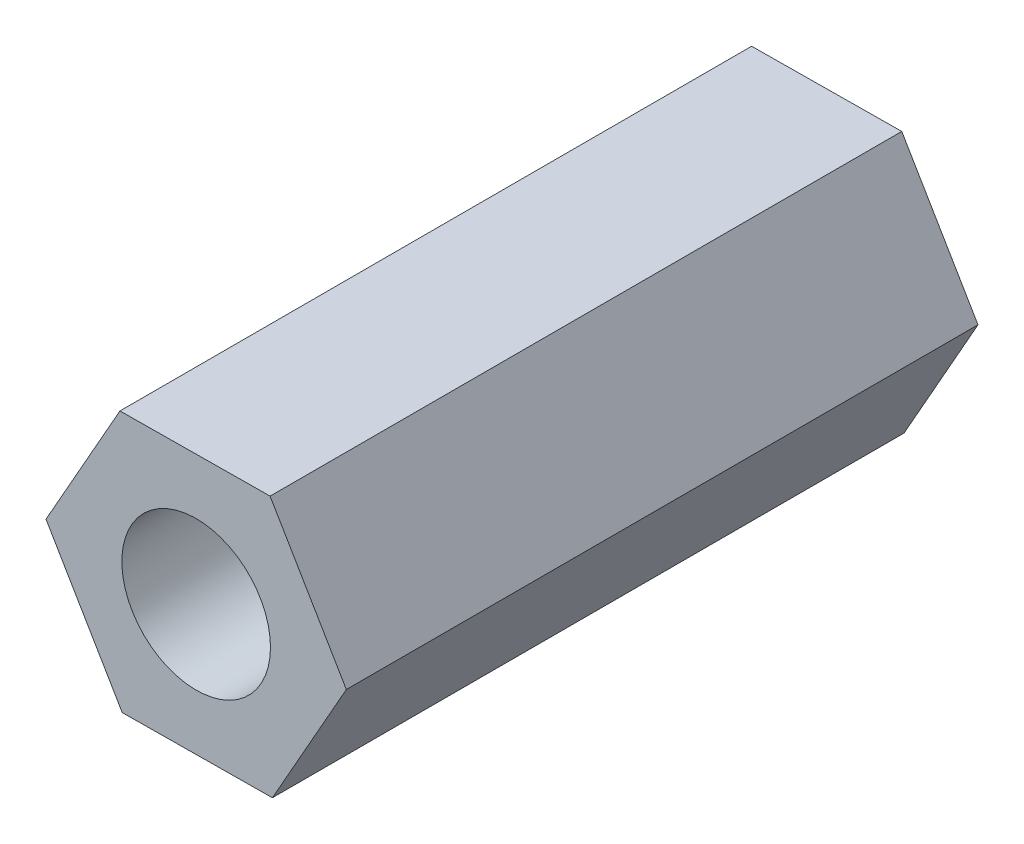
from build123d import *

# Parameters (mm, degrees)
SKETCH_1_R      = 2
EXTRUDE_1_DEPTH = 17


with BuildPart() as part:
    # 草图1 → 凸台-拉伸1 (new body)
    with BuildSketch(Plane.XY):
        Polygon((2.051456248, -3.482077052), (4.041295309, 0.035574699), (1.989839061, 3.517651751), (-2.051456248, 3.482077052), (-4.041295309, -0.035574699), (-1.989839061, -3.517651751), align=None)
        Circle(SKETCH_1_R, mode=Mode.SUBTRACT)
    extrude(amount=EXTRUDE_1_DEPTH)


solid = part.part
